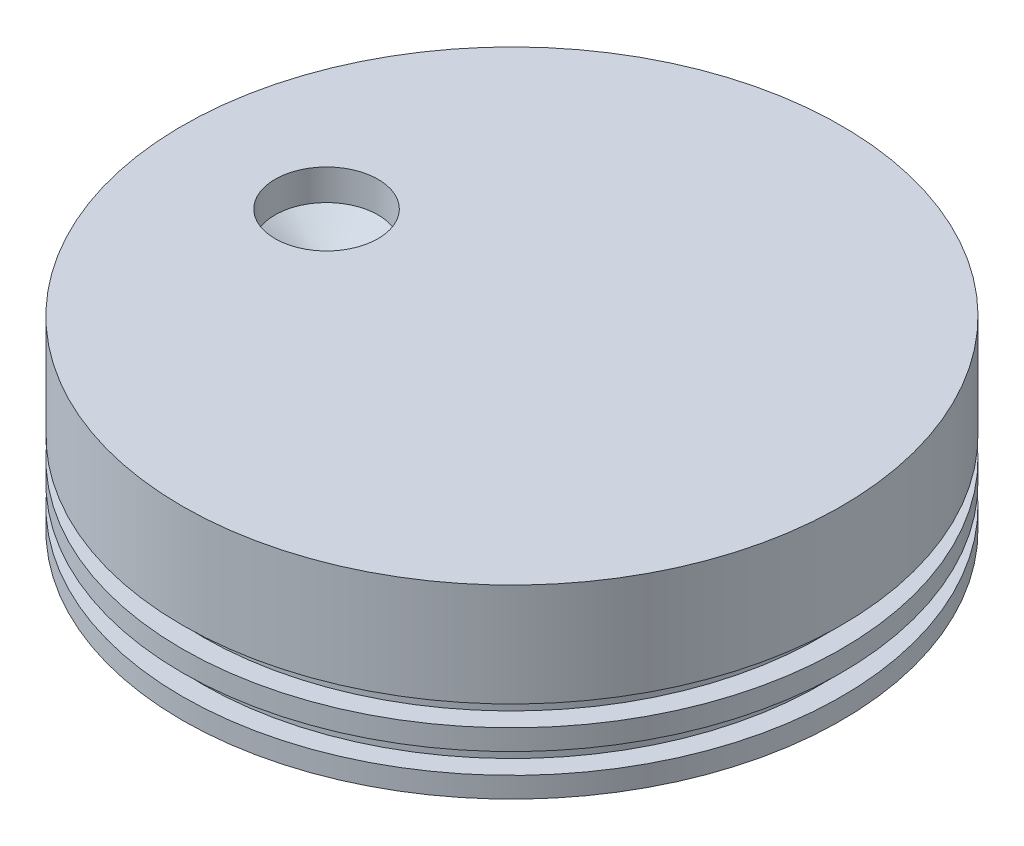
from build123d import *

# Parameters (mm, degrees)
F_1_4_0_25_DIAMETER_HOLE6_D     = 6.35
F_1_4_0_25_DIAMETER_HOLE6_DEPTH = 1.902267535
F_1_4_0_25_DIAMETER_HOLE6_TIP   = 1.907732465


with BuildPart() as part:
    # Sketch2 → base_revolve (revolve)
    with BuildSketch(Plane.XY, mode=Mode.PRIVATE) as base_revolve_sk:
        Polygon((20.32, 0), (20.32, -11.43), (0, -11.43), (0, -10.16), (1.27, -10.16), (1.27, -8.89), (0, -8.89), (0, -7.62), (1.27, -7.62), (1.27, -6.35), (0, -6.35), (0, 0), align=None)
    revolve(base_revolve_sk.sketch.rotate(Axis((20.32, 0, 0), (0, -1, 0)), 270), axis=Axis((20.32, 0, 0), (0, -1, 0)))

    # 1/4 (0.25) Diameter Hole6
    with Locations(Plane(origin=(0, 0, 0), x_dir=(1, 0, 0), z_dir=(0, 1, 0))):
        with Locations((8.89, 0)):
            Hole(F_1_4_0_25_DIAMETER_HOLE6_D / 2, depth=F_1_4_0_25_DIAMETER_HOLE6_DEPTH)
            with Locations((0, 0, -(F_1_4_0_25_DIAMETER_HOLE6_DEPTH + F_1_4_0_25_DIAMETER_HOLE6_TIP / 2))):  # 118° drill point
                Cone(0, F_1_4_0_25_DIAMETER_HOLE6_D / 2, F_1_4_0_25_DIAMETER_HOLE6_TIP, mode=Mode.SUBTRACT)


solid = part.part
